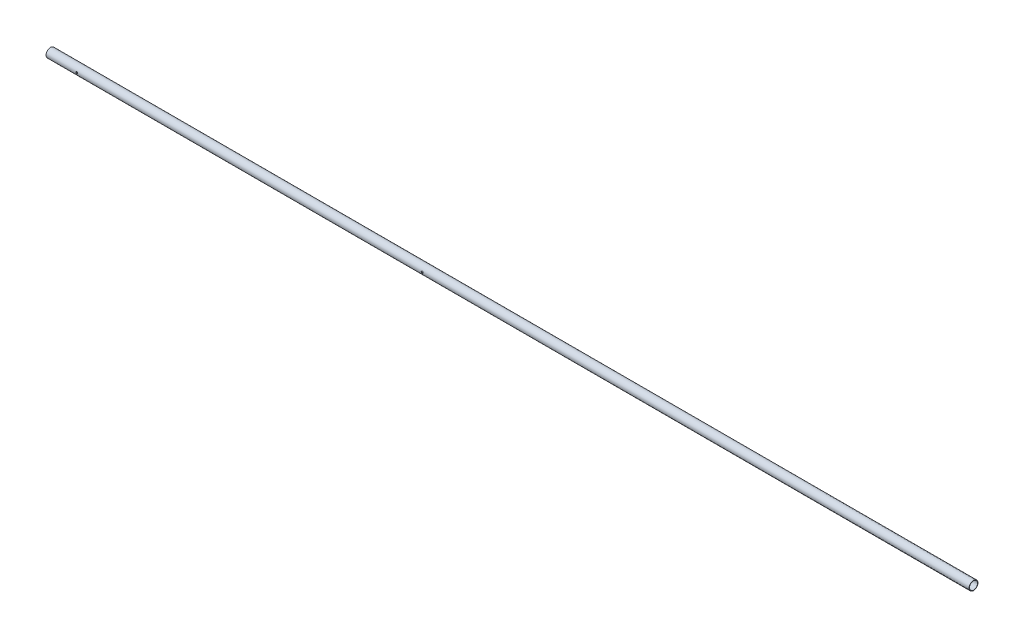
from build123d import *

# Parameters (mm, degrees)
SKETCH3_R               = 14.7701
SKETCH3_R_2             = 13.3223
BOSS_EXTRUDE1_DEPTH     = 3048
CUT_EXTRUDE1_DEPTH      = 3049.071572603
CUT_EXTRUDE1_DEPTH_BACK = 3049.071572603
SKETCH6_R               = 3.175


with BuildPart() as part:
    # Sketch3 → Boss-Extrude1 (new body)
    with BuildSketch(Plane(origin=(0, 0, 0), x_dir=(0, 0, -1), z_dir=(1, 0, 0))):
        Circle(SKETCH3_R)
        Circle(SKETCH3_R_2, mode=Mode.SUBTRACT)
    extrude(amount=BOSS_EXTRUDE1_DEPTH)

    # Sketch6 → Cut-Extrude1 (cut, two sides: drawn at the far end of the back side and taken through both)
    with BuildSketch(Plane.XY.offset(-CUT_EXTRUDE1_DEPTH_BACK)):
        with Locations((101.6, 0)):
            Circle(SKETCH6_R)
        with Locations((1242.06, 0)):
            Circle(SKETCH6_R)
    extrude(amount=CUT_EXTRUDE1_DEPTH + CUT_EXTRUDE1_DEPTH_BACK, mode=Mode.SUBTRACT)


solid = part.part
